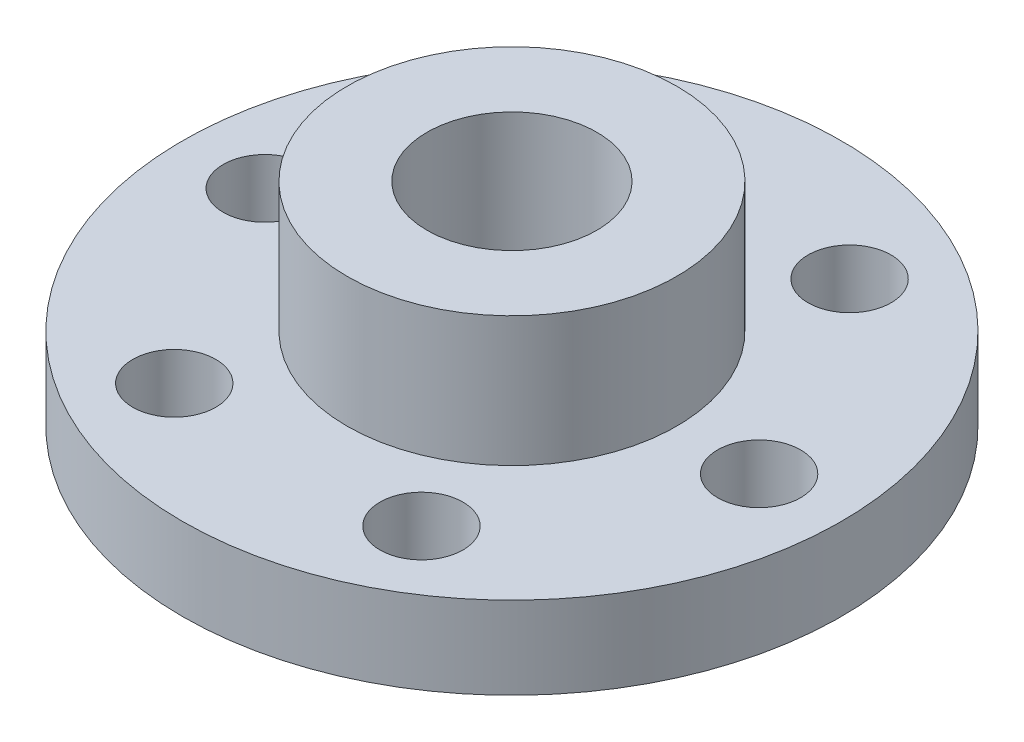
from build123d import *

# Parameters (mm, degrees)
SKETCH1_R            = 25.4
SKETCH1_R_2          = 4.826
MAIN_BODY_DEPTH      = 6.35
SKETCH2_R            = 12.7
SKETCH2_R_2          = 6.5484375
TAP_BOSS_DEPTH       = 10.000000066
M6_CLEARANCE_HOLE1_D = 6.4


with BuildPart() as part:
    # Sketch1 → main body (new body)
    with BuildSketch(Plane(origin=(0, 0, 0), x_dir=(1, 0, 0), z_dir=(0, 1, 0))):
        with Locations(Location((0, 0, 0), (0, 0, 270))):
            Circle(SKETCH1_R)
        with Locations(Location((0, 0, 0), (0, 0, 270))):
            Circle(SKETCH1_R_2, mode=Mode.SUBTRACT)
    extrude(amount=MAIN_BODY_DEPTH)

    # Sketch2 → tap boss (add)
    with BuildSketch(Plane(origin=(0, 6.35, 0), x_dir=(1, 0, 0), z_dir=(0, 1, 0))):
        with Locations(Location((0, 0, 0), (0, 0, 270))):
            Circle(SKETCH2_R)
        with Locations(Location((0, 0, 0), (0, 0, 270))):
            Circle(SKETCH2_R_2, mode=Mode.SUBTRACT)
    extrude(amount=TAP_BOSS_DEPTH)

    # M6 Clearance Hole1 (through all)
    with Locations(Plane(origin=(0, 6.35, 0), x_dir=(1, 0, 0), z_dir=(0, 1, 0))):
        with Locations((-19.05, 0), (-9.525, 16.497783942), (9.525, 16.497783942), (19.05, 0), (9.525, -16.497783942), (-9.525, -16.497783942), (0, 0)):
            Hole(M6_CLEARANCE_HOLE1_D / 2)


solid = part.part
